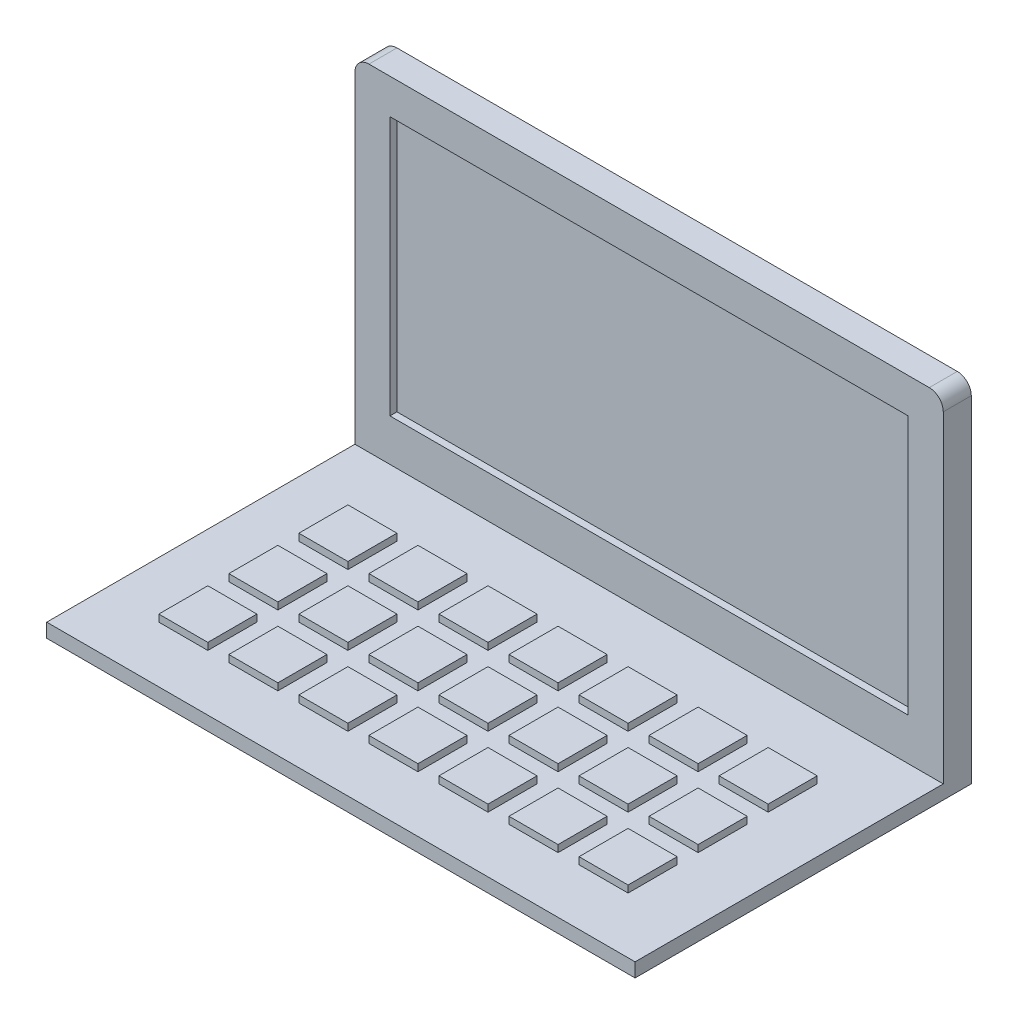
from build123d import *

# Parameters (mm, degrees)
SKETCH1_W           = 4.2
SKETCH1_H           = 2.5
BOSS_EXTRUDE1_DEPTH = 0.2
SKETCH2_W           = 3.7
SKETCH2_H           = 1.85
CUT_EXTRUDE1_DEPTH  = 0.05
SKETCH3_W           = 2.4
SKETCH3_H           = 0.1
BOSS_EXTRUDE3_DEPTH = 4.2
FILLET3_R           = 0.1
SKETCH4_W           = 0.35
SKETCH4_H           = 0.35
BOSS_EXTRUDE4_DEPTH = 0.05


with BuildPart() as part:
    # Sketch1 → Boss-Extrude1 (new body)
    with BuildSketch(Plane.XY):
        with Locations((2.1, 1.25)):
            Rectangle(SKETCH1_W, SKETCH1_H)
    extrude(amount=BOSS_EXTRUDE1_DEPTH)

    # Sketch2 → Cut-Extrude1 (cut)
    with BuildSketch(Plane.XY.offset(0.2)):
        with Locations((2.1, 1.325)):
            Rectangle(SKETCH2_W, SKETCH2_H)
    extrude(amount=-CUT_EXTRUDE1_DEPTH, mode=Mode.SUBTRACT)

    # Sketch3 → Boss-Extrude3 (add)
    with BuildSketch(Plane.ZY):
        with Locations((1.2, 0.05)):
            Rectangle(SKETCH3_W, SKETCH3_H)
    extrude(amount=-BOSS_EXTRUDE3_DEPTH)

    # Fillet3
    fillet3_edges = [part.edges().sort_by_distance(p)[0] for p in [
        (0, 2.5, 0.1),
        (4.2, 2.5, 0.1),
    ]]
    fillet(fillet3_edges, radius=FILLET3_R)

    # Sketch4 → Boss-Extrude4 (add)
    with BuildSketch(Plane(origin=(0, 0.1, 0), x_dir=(1, 0, 0), z_dir=(0, 1, 0))):
        with Locations((0.575, -1.825)):
            Rectangle(SKETCH4_W, SKETCH4_H)
        with Locations((1.075, -1.825)):
            Rectangle(SKETCH4_W, SKETCH4_H)
        with Locations((1.575, -1.825)):
            Rectangle(SKETCH4_W, SKETCH4_H)
        with Locations((2.075, -1.825)):
            Rectangle(SKETCH4_W, SKETCH4_H)
        with Locations((2.575, -1.825)):
            Rectangle(SKETCH4_W, SKETCH4_H)
        with Locations((3.075, -1.825)):
            Rectangle(SKETCH4_W, SKETCH4_H)
        with Locations((3.575, -1.825)):
            Rectangle(SKETCH4_W, SKETCH4_H)
        with Locations((1.075, -1.325)):
            Rectangle(SKETCH4_W, SKETCH4_H)
        with Locations((1.575, -1.325)):
            Rectangle(SKETCH4_W, SKETCH4_H)
        with Locations((2.075, -1.325)):
            Rectangle(SKETCH4_W, SKETCH4_H)
        with Locations((2.575, -1.325)):
            Rectangle(SKETCH4_W, SKETCH4_H)
        with Locations((3.075, -1.325)):
            Rectangle(SKETCH4_W, SKETCH4_H)
        with Locations((3.575, -1.325)):
            Rectangle(SKETCH4_W, SKETCH4_H)
        with Locations((1.075, -0.825)):
            Rectangle(SKETCH4_W, SKETCH4_H)
        with Locations((1.575, -0.825)):
            Rectangle(SKETCH4_W, SKETCH4_H)
        with Locations((2.075, -0.825)):
            Rectangle(SKETCH4_W, SKETCH4_H)
        with Locations((2.575, -0.825)):
            Rectangle(SKETCH4_W, SKETCH4_H)
        with Locations((3.075, -0.825)):
            Rectangle(SKETCH4_W, SKETCH4_H)
        with Locations((3.575, -0.825)):
            Rectangle(SKETCH4_W, SKETCH4_H)
        with Locations((0.575, -1.325)):
            Rectangle(SKETCH4_W, SKETCH4_H)
        with Locations((0.575, -0.825)):
            Rectangle(SKETCH4_W, SKETCH4_H)
    extrude(amount=BOSS_EXTRUDE4_DEPTH)


solid = part.part
